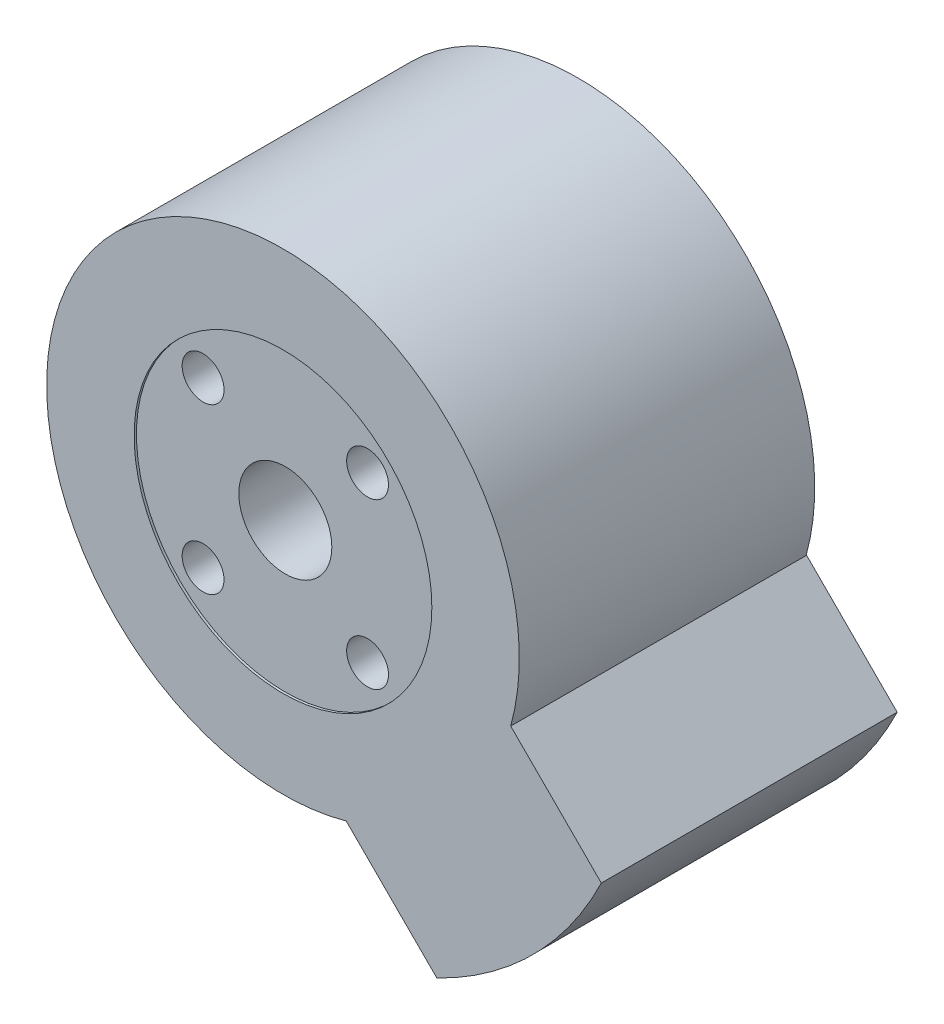
from build123d import *

# Parameters (mm, degrees)
SKETCH1_R            = 25.4
BOSS_EXTRUDE1_DEPTH  = 31.75
SKETCH2_R            = 16
CUT_EXTRUDE1_DEPTH   = 0.25
M4_CLEARANCE_HOLE1_D = 4.5
SKETCH6_R            = 5
CUT_EXTRUDE2_DEPTH   = 48.77624933
BOSS_EXTRUDE2_DEPTH  = 31.8


with BuildPart() as part:
    # Sketch1 → Boss-Extrude1 (new body)
    with BuildSketch(Plane.XY):
        Circle(SKETCH1_R)
    extrude(amount=-BOSS_EXTRUDE1_DEPTH)

    # Sketch2 → Cut-Extrude1 (cut)
    with BuildSketch(Plane.XY):
        Circle(SKETCH2_R)
    extrude(amount=-CUT_EXTRUDE1_DEPTH, mode=Mode.SUBTRACT)

    # M4 Clearance Hole1 (through all)
    with Locations(Plane.XY.offset(-0.25)):
        with Locations((-8.838834765, 8.838834765), (8.838834765, 8.838834765), (-8.838834765, -8.838834765), (8.838834765, -8.838834765)):
            Hole(M4_CLEARANCE_HOLE1_D / 2)

    # Sketch6 → Cut-Extrude2 (cut, through all)
    with BuildSketch(Plane.XY.offset(-0.25)):
        Circle(SKETCH6_R)
    extrude(amount=-CUT_EXTRUDE2_DEPTH, mode=Mode.SUBTRACT)

    # Sketch8 → Boss-Extrude2 (add)
    with BuildSketch(Plane.XY):
        with BuildLine():
            Line((6.796221999, -24.473891528), (16.535857352, -34.213526881))
            ThreePointArc((16.535857352, -34.213526881), (26.870057685, -26.870057685), (34.213526881, -16.535857352))
            Line((34.213526881, -16.535857352), (24.473891528, -6.796221999))
            ThreePointArc((24.473891528, -6.796221999), (17.960512242, -17.960512242), (6.796221999, -24.473891528))
        make_face()
    extrude(amount=-BOSS_EXTRUDE2_DEPTH)


solid = part.part
